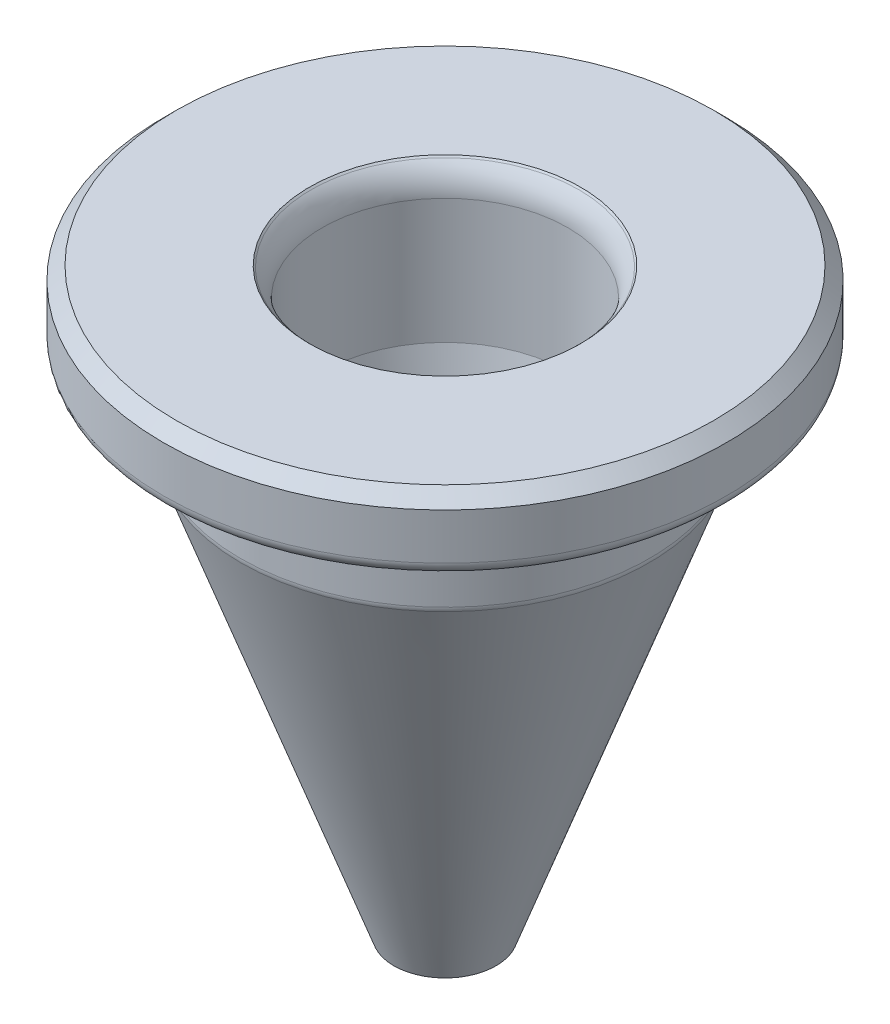
from build123d import *

# Parameters (mm, degrees)
FL_CHE_VERSCHIEBEN1_BY          = 1
AUFSATZ_LINEAR_START            = -2.8
SKIZZE2_R                       = 11
SKIZZE2_R_2                     = 4.8
AUFSATZ_LINEAR_AUSTRAGEN1_DEPTH = 2.8
VERRUNDUNG1_R                   = 0.5
FASE1_SIZE                      = 0.5
VERRUNDUNG2_R                   = 1.5


with BuildPart() as part:
    # Skizze1 → Rotation1 (revolve)
    with BuildSketch(Plane.XY, mode=Mode.PRIVATE) as rotation1_sk:
        Polygon((1.5, 0), (4.8, 17), (4.8, 22), (8, 22), (8, 17), (2, 0.3), align=None)
    revolve(rotation1_sk.sketch.rotate(Axis((0, 0, 0), (0, 1, 0)), 270), axis=Axis((0, 0, 0), (0, 1, 0)))

    # Fläche verschieben1: a face moved outward by 1.0
    extrude(part.faces().sort_by_distance((-6.4, 22, 0))[0], amount=FL_CHE_VERSCHIEBEN1_BY, dir=(0, 1, 0))

    # Skizze2 → Aufsatz-Linear austragen1 (add)
    with BuildSketch(Plane(origin=(0, 23, 0), x_dir=(1, 0, 0), z_dir=(0, 1, 0)).offset(AUFSATZ_LINEAR_START)):
        with Locations(Location((0, 0, 0), (0, 0, 270))):
            Circle(SKIZZE2_R)
        with Locations(Location((0, 0, 0), (0, 0, 270))):
            Circle(SKIZZE2_R_2, mode=Mode.SUBTRACT)
    extrude(amount=AUFSATZ_LINEAR_AUSTRAGEN1_DEPTH)

    # Verrundung1
    verrundung1_edges = [part.edges().sort_by_distance(p)[0] for p in [
        (0, 20.2, -8),
        (0, 20.2, -11),
        (0, 17, -8),
    ]]
    fillet(verrundung1_edges, radius=VERRUNDUNG1_R)

    # Fase1
    fase1_edges = [part.edges().sort_by_distance(p)[0] for p in [
        (0, 23, -11),
        (0, 23, -4.8),
    ]]
    chamfer(fase1_edges, length=FASE1_SIZE)

    # Verrundung2
    verrundung2_edges = [part.edges().sort_by_distance(p)[0] for p in [
        (0, 22.5, -4.8),
    ]]
    fillet(verrundung2_edges, radius=VERRUNDUNG2_R)


solid = part.part
